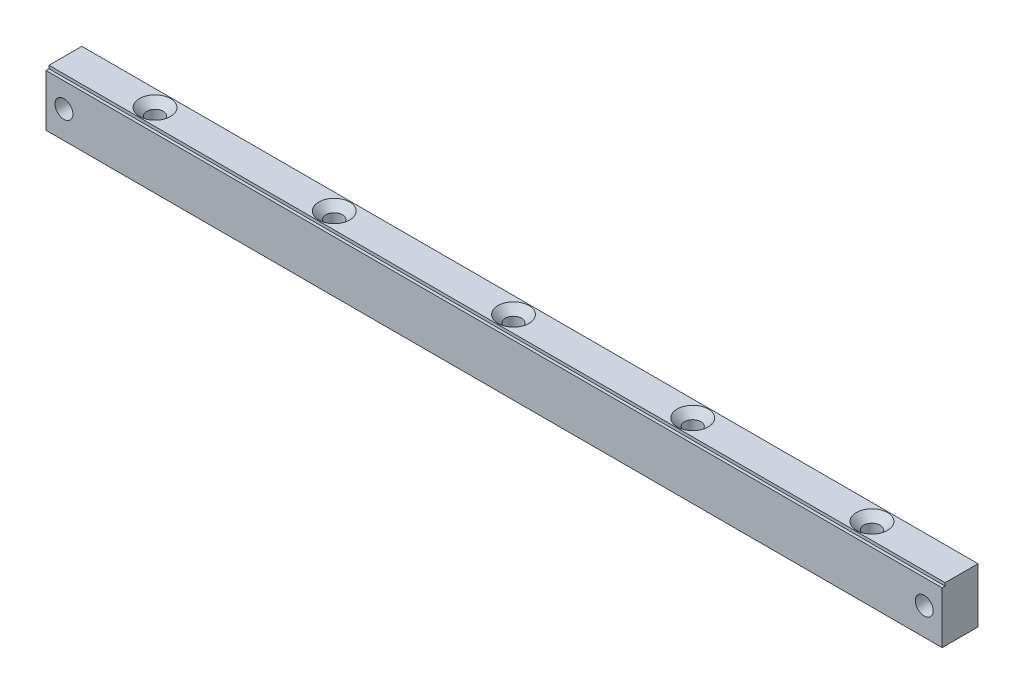
from build123d import *

# Parameters (mm, degrees)
SKETCH_1_W                 = 300
SKETCH_1_H                 = 12
EXTRUDE_275_DEPTH          = 18.35
SKETCH_2_W                 = 300
SKETCH_2_H                 = 1
CUT_EXTRUDE_1_DEPTH        = 1
HOLE_WIZARD_M4_D           = 5.5
HOLE_WIZARD_M4_CSINK_D     = 10.4
HOLE_WIZARD_M4_CSINK_ANGLE = 90
PATTERN_LINEAR_1_COUNT     = 3
PATTERN_LINEAR_1_PITCH     = 60
PATTERN_LINEAR_1_COL_COUNT = 3
PATTERN_LINEAR_1_COL_PITCH = 60
SKETCH_5_R                 = 3
CUT_EXTRUDE_6_DEPTH        = 152.593939523


with BuildPart() as part:
    # Эскиз1 → Extrude 275 (new body)
    with BuildSketch(Plane(origin=(0, 0, 0), x_dir=(1, 0, 0), z_dir=(0, 1, 0))):
        with Locations((0, 6)):
            Rectangle(SKETCH_1_W, SKETCH_1_H)
    extrude(amount=EXTRUDE_275_DEPTH)

    # Эскиз2 → Вырез-Вытянуть1 (cut)
    with BuildSketch(Plane(origin=(0, 18.35, 0), x_dir=(1, 0, 0), z_dir=(0, 1, 0))):
        with Locations((0, 0.5)):
            Rectangle(SKETCH_2_W, SKETCH_2_H)
    extrude(amount=-CUT_EXTRUDE_1_DEPTH, mode=Mode.SUBTRACT)

    # Крепление-M4 (through all)
    with Locations(Plane(origin=(0, 18.35, 0), x_dir=(-1, 0, 0), z_dir=(0, 1, 0))):
        with Locations((0, -6.5)):
            hole_wizard_m4 = CounterSinkHole(HOLE_WIZARD_M4_D / 2, HOLE_WIZARD_M4_CSINK_D / 2, counter_sink_angle=HOLE_WIZARD_M4_CSINK_ANGLE)

    # Линейный массив1: Крепление-M4 ×3
    with Locations(*[(-i * PATTERN_LINEAR_1_PITCH, 0, 0) for i in range(1, PATTERN_LINEAR_1_COUNT)]):
        add(hole_wizard_m4, mode=Mode.SUBTRACT)

    # Линейный массив1 col: Крепление-M4 ×3
    with Locations(*[(i * PATTERN_LINEAR_1_COL_PITCH, 0, 0) for i in range(1, PATTERN_LINEAR_1_COL_COUNT)]):
        add(hole_wizard_m4, mode=Mode.SUBTRACT)

    # Эскиз5 → Валы-6мм (cut, through all)
    with BuildSketch(Plane.XY.offset(-12)):
        with Locations((-144, 9.175)):
            Circle(SKETCH_5_R)
        with Locations((144, 9.175)):
            Circle(SKETCH_5_R)
    extrude(amount=CUT_EXTRUDE_6_DEPTH, mode=Mode.SUBTRACT)


solid = part.part
